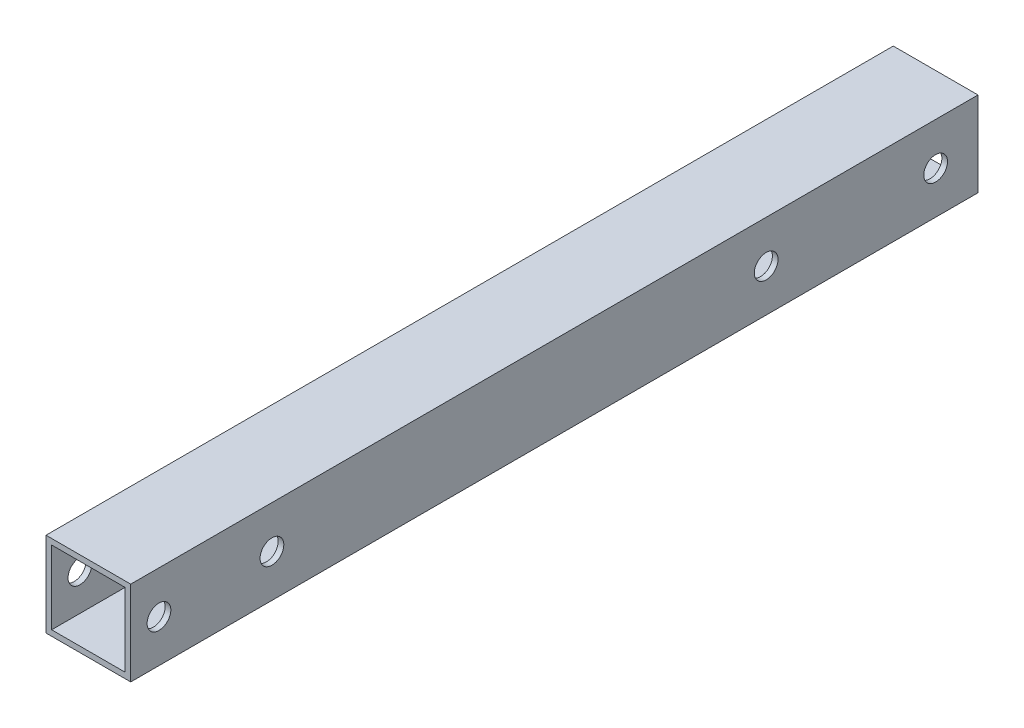
from build123d import *

# Parameters (mm, degrees)
SKETCH_1_W          = 15
SKETCH_1_H          = 15
SKETCH_1_W_2        = 13
SKETCH_1_H_2        = 13
EXTRUDE_1_DEPTH     = 150
SKETCH_2_R          = 2.1
CUT_EXTRUDE_1_DEPTH = 151.934588481
SKETCH_4_R          = 2.1
CUT_EXTRUDE_3_DEPTH = 151.934588481


with BuildPart() as part:
    # ｽｹｯﾁ1 → 押し出し-薄板1 (new body)
    with BuildSketch(Plane.XY):
        Rectangle(SKETCH_1_W, SKETCH_1_H)
        Rectangle(SKETCH_1_W_2, SKETCH_1_H_2, mode=Mode.SUBTRACT)
    extrude(amount=EXTRUDE_1_DEPTH)

    # ｽｹｯﾁ2 → ｶｯﾄ - 押し出し1 (cut, through all)
    with BuildSketch(Plane(origin=(7.5, 0, 0), x_dir=(0, 0, -1), z_dir=(1, 0, 0))):
        with Locations(Location((-7.5, 0, 0), (0, 0, 90))):
            Circle(SKETCH_2_R)
        with Locations(Location((-37.5, 0, 0), (0, 0, 90))):
            Circle(SKETCH_2_R)
    extrude(amount=-CUT_EXTRUDE_1_DEPTH, mode=Mode.SUBTRACT)

    # ｽｹｯﾁ4 → ｶｯﾄ - 押し出し3 (cut, through all)
    with BuildSketch(Plane(origin=(7.5, 0, 0), x_dir=(0, 0, -1), z_dir=(1, 0, 0))):
        with Locations(Location((-145, 0, 0), (0, 0, 90))):
            Circle(SKETCH_4_R)
        with Locations(Location((-125, 0, 0), (0, 0, 90))):
            Circle(SKETCH_4_R)
    extrude(amount=-CUT_EXTRUDE_3_DEPTH, mode=Mode.SUBTRACT)


solid = part.part
